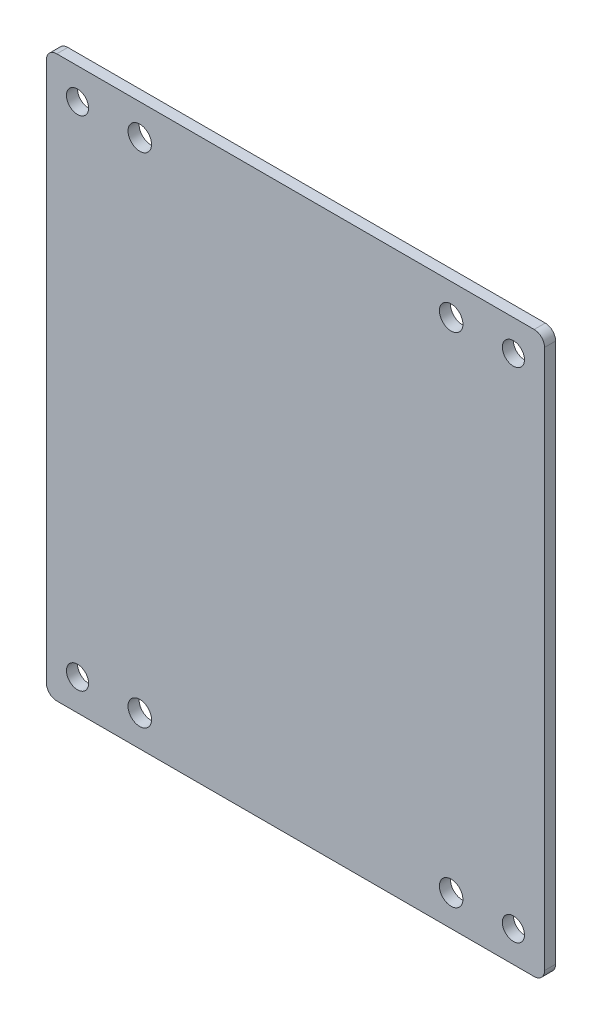
from build123d import *

# Parameters (mm, degrees)
MODEL_R                 = 1.7
MODEL_R_2               = 1.600279216
SALIENTE_EXTRUIR1_DEPTH = 1.6


with BuildPart() as part:
    # Model → Saliente-Extruir1 (new body)
    with BuildSketch(Plane.XY):
        with BuildLine():
            Line((79.069803803, 220.603820632), (79.069803803, 298.60843049))
            ThreePointArc((79.069803803, 298.60843049), (78.630463975, 299.669090662), (77.569803803, 300.10843049))
            Line((77.569803803, 300.10843049), (8.567399569, 300.10843049))
            ThreePointArc((8.567399569, 300.10843049), (7.506739397, 299.669090662), (7.067399569, 298.60843049))
            Line((7.067399569, 298.60843049), (7.067399569, 220.603820632))
            ThreePointArc((7.067399569, 220.603820632), (7.506739397, 219.54316046), (8.567399569, 219.103820632))
            Line((8.567399569, 219.103820632), (77.569803803, 219.103820632))
            ThreePointArc((77.569803803, 219.103820632), (78.630463975, 219.54316046), (79.069803803, 220.603820632))
        make_face()
        with Locations((20.566730565, 223.60348613)):
            Circle(MODEL_R, mode=Mode.SUBTRACT)
        with Locations((65.570138305, 223.60348613)):
            Circle(MODEL_R, mode=Mode.SUBTRACT)
        with Locations((11.567065067, 223.60348613)):
            Circle(MODEL_R_2, mode=Mode.SUBTRACT)
        with Locations((74.569803803, 223.60348613)):
            Circle(MODEL_R_2, mode=Mode.SUBTRACT)
        with Locations((20.566730565, 295.60843049)):
            Circle(MODEL_R, mode=Mode.SUBTRACT)
        with Locations((65.570138305, 295.60843049)):
            Circle(MODEL_R, mode=Mode.SUBTRACT)
        with Locations((74.569803803, 295.60843049)):
            Circle(MODEL_R_2, mode=Mode.SUBTRACT)
        with Locations((11.567065067, 295.60843049)):
            Circle(MODEL_R_2, mode=Mode.SUBTRACT)
    extrude(amount=SALIENTE_EXTRUIR1_DEPTH)


solid = part.part
